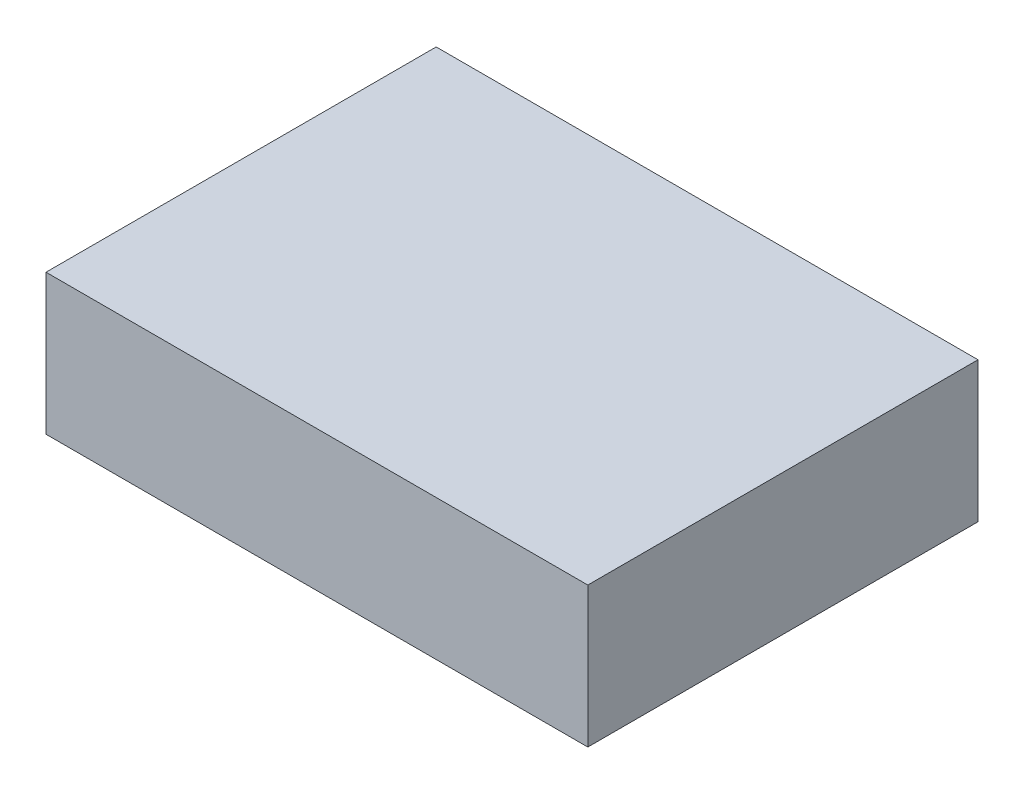
from build123d import *

# Parameters (mm, degrees)
SKETCH1_W           = 31.66
SKETCH1_H           = 22.8
BOSS_EXTRUDE1_DEPTH = 8.2


with BuildPart() as part:
    # Sketch1 → Boss-Extrude1 (new body)
    with BuildSketch(Plane(origin=(0, 0, 0), x_dir=(1, 0, 0), z_dir=(0, 1, 0))):
        with Locations((15.83, 11.4)):
            Rectangle(SKETCH1_W, SKETCH1_H)
    extrude(amount=BOSS_EXTRUDE1_DEPTH)


solid = part.part
